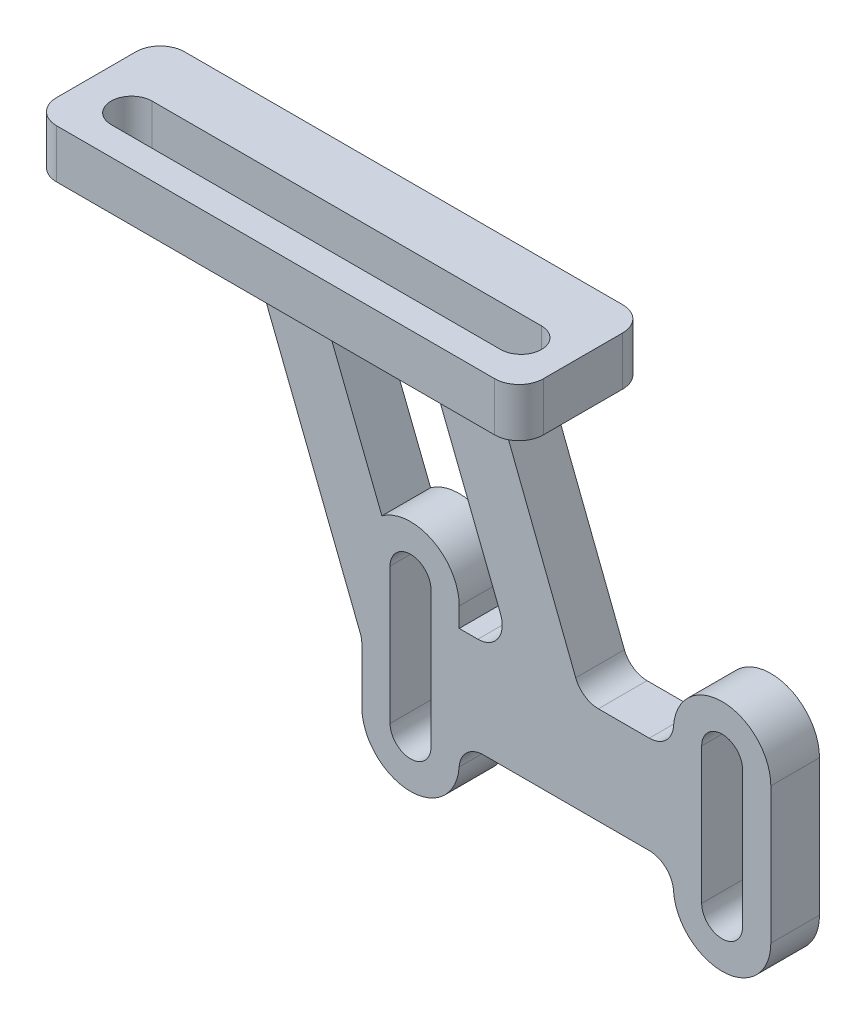
from build123d import *

# Parameters (mm, degrees)
SKETCH1_W           = 25
SKETCH1_H           = 8.15
SKETCH1_R           = 2.1
BOSS_EXTRUDE1_DEPTH = 5
BOSS_EXTRUDE3_DEPTH = 5
FILLET1_R           = 2.5
SKETCH4_R           = 2.1
BOSS_EXTRUDE4_DEPTH = 5
CUT_EXTRUDE1_DEPTH  = 5
FILLET2_R           = 2.5


with BuildPart() as part:
    # Sketch1 → Boss-Extrude1 (new body)
    with BuildSketch(Plane(origin=(0, 0, 0), x_dir=(1, 0, 0), z_dir=(0, 1, 0))):
        with Locations((8, -0.925)):
            Rectangle(SKETCH1_W, SKETCH1_H)
        with Locations(Location((16, 0, 0), (0, 0, 270))):
            Circle(SKETCH1_R, mode=Mode.SUBTRACT)
        with Locations(Location((0, 0, 0), (0, 0, 270))):
            Circle(SKETCH1_R, mode=Mode.SUBTRACT)
    extrude(amount=BOSS_EXTRUDE1_DEPTH)

    # Sketch3 → Boss-Extrude3 (add)
    with BuildSketch(Plane(origin=(0, 0, -3.15), x_dir=(-1, 0, 0), z_dir=(0, 0, -1))):
        with BuildLine():
            Line((-20.5, 5), (4.5, 5))
            Line((4.5, 5), (4.5, 0))
            Line((4.5, 0), (-8.5, -33.101126286))
            Line((-8.5, -33.101126286), (-8.5, -39.18452209))
            ThreePointArc((-8.5, -39.18452209), (-13.5, -44.18452209), (-18.5, -39.18452209))
            Line((-18.5, -39.18452209), (-18.5, -37.18452209))
            Line((-18.5, -37.18452209), (-40.5, -37.18452209))
            Line((-40.5, -37.18452209), (-40.5, -39.18452209))
            ThreePointArc((-40.5, -39.18452209), (-45.5, -44.18452209), (-50.5, -39.18452209))
            Line((-50.5, -39.18452209), (-50.5, -25.18452209))
            ThreePointArc((-50.5, -25.18452209), (-45.5, -20.18452209), (-40.5, -25.18452209))
            Line((-40.5, -25.18452209), (-40.5, -27.18452209))
            Line((-40.5, -27.18452209), (-31.083364815, -27.18452209))
            Line((-31.083364815, -27.18452209), (-20.5, 0))
            Line((-20.5, 0), (-20.5, 5))
        make_face()
        with BuildLine():
            Line((-6.051156406, -4.816080861), (-15.253856658, -4.816080861))
            Line((-15.253856658, -4.816080861), (-24.092524325, -27.18452209))
            Line((-24.092524325, -27.18452209), (-18.5, -27.18452209))
            Line((-18.5, -27.18452209), (-18.5, -25.18452209))
            ThreePointArc((-18.5, -25.18452209), (-15.76759292, -20.728287991), (-10.55679106, -21.142552133))
            Line((-10.55679106, -21.142552133), (-4.105547887, -4.816080861))
            Line((-4.105547887, -4.816080861), (-6.051156406, -4.816080861))
        make_face(mode=Mode.SUBTRACT)
        with BuildLine():
            Line((-15.6, -39.18452209), (-15.6, -25.18452209))
            ThreePointArc((-15.6, -25.18452209), (-13.5, -23.08452209), (-11.4, -25.18452209))
            Line((-11.4, -25.18452209), (-11.4, -39.18452209))
            ThreePointArc((-11.4, -39.18452209), (-13.5, -41.28452209), (-15.6, -39.18452209))
        make_face(mode=Mode.SUBTRACT)
        with BuildLine():
            Line((-43.4, -25.18452209), (-43.4, -39.18452209))
            ThreePointArc((-43.4, -39.18452209), (-45.5, -41.28452209), (-47.6, -39.18452209))
            Line((-47.6, -39.18452209), (-47.6, -25.18452209))
            ThreePointArc((-47.6, -25.18452209), (-45.5, -23.08452209), (-43.4, -25.18452209))
        make_face(mode=Mode.SUBTRACT)
    extrude(amount=BOSS_EXTRUDE3_DEPTH)

    # Fillet1
    fillet1_edges = [part.edges().sort_by_distance(p)[0] for p in [
        (-4.5, 2.5, 5),
        (20.5, 2.5, 5),
        (31.083364815, -27.18452209, -5.65),
        (24.092524325, -27.18452209, -5.65),
        (15.253856658, -4.816080861, -5.65),
        (40.5, -27.18452209, -5.65),
        (8.5, -33.101126286, -5.65),
        (40.5, -37.18452209, -5.65),
        (18.5, -37.18452209, -5.65),
    ]]
    fillet(fillet1_edges, radius=FILLET1_R)

    # Sketch4 → Boss-Extrude4 (add)
    # profile 1 of 3: a face of its own
    with BuildSketch(Plane(origin=(0, 5, 0), x_dir=(1, 0, 0), z_dir=(0, 1, 0))):
        with BuildLine():
            ThreePointArc((20.5, -2.5), (19.767766953, -4.267766953), (18, -5))
            Line((18, -5), (32.792852268, -5))
            Line((32.792852268, -5), (32.792852268, 8.15))
            Line((32.792852268, 8.15), (20.5, 8.15))
            Line((20.5, 8.15), (20.5, -2.5))
        make_face()
    # profile 2 of 3: a face of its own
    with BuildSketch(Plane(origin=(0, 5, 0), x_dir=(1, 0, 0), z_dir=(0, 1, 0))):
        with BuildLine():
            Line((-2, -5), (18, -5))
            Line((18, -5), (18, -0.640312424))
            ThreePointArc((18, -0.640312424), (13.9, 0), (18, 0.640312424))
            Line((18, 0.640312424), (18, 8.15))
            Line((18, 8.15), (-4.5, 8.15))
            Line((-4.5, 8.15), (-4.5, -2.5))
            ThreePointArc((-4.5, -2.5), (-3.767766953, -4.267766953), (-2, -5))
        make_face()
        with Locations(Location((0, 0, 0), (0, 0, 270))):
            Circle(SKETCH4_R, mode=Mode.SUBTRACT)
    # profile 3 of 3: a face of its own
    with BuildSketch(Plane(origin=(0, 5, 0), x_dir=(1, 0, 0), z_dir=(0, 1, 0))):
        with BuildLine():
            Line((-17.207147732, -5), (-2, -5))
            ThreePointArc((-2, -5), (-3.767766953, -4.267766953), (-4.5, -2.5))
            Line((-4.5, -2.5), (-4.5, 8.15))
            Line((-4.5, 8.15), (-17.207147732, 8.15))
            Line((-17.207147732, 8.15), (-17.207147732, -5))
        make_face()
    extrude(amount=-BOSS_EXTRUDE4_DEPTH)

    # Sketch5 → Cut-Extrude1 (cut)
    with BuildSketch(Plane(origin=(0, 5, 0), x_dir=(1, 0, 0), z_dir=(0, 1, 0))):
        with BuildLine():
            Line((-12, 2.1), (28, 2.1))
            ThreePointArc((28, 2.1), (30.1, 0), (28, -2.1))
            Line((28, -2.1), (-12, -2.1))
            ThreePointArc((-12, -2.1), (-14.1, 0), (-12, 2.1))
        make_face()
    extrude(amount=-CUT_EXTRUDE1_DEPTH, mode=Mode.SUBTRACT)

    # Fillet2
    fillet2_edges = [part.edges().sort_by_distance(p)[0] for p in [
        (32.792852268, 2.5, 5),
        (32.792852268, 2.5, -8.15),
        (-17.207147732, 2.5, 5),
        (-17.207147732, 2.5, -8.15),
    ]]
    fillet(fillet2_edges, radius=FILLET2_R)


solid = part.part
